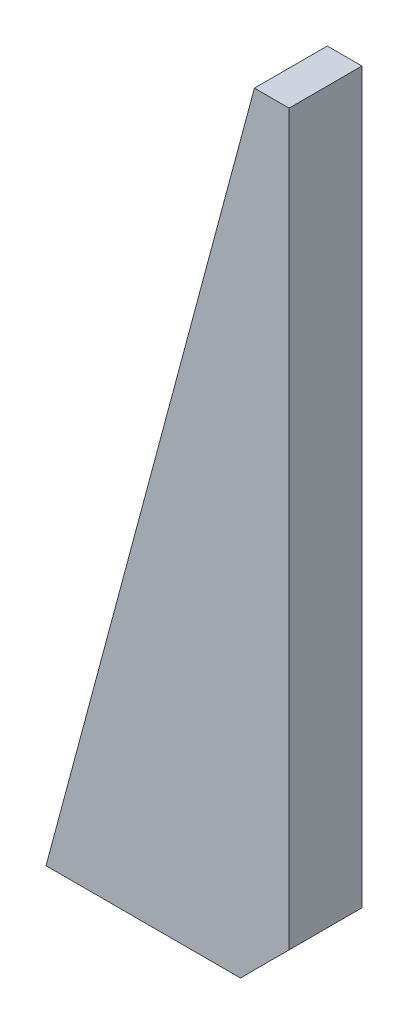
from build123d import *

# Parameters (mm, degrees)
BOSS_EXTRUDE1_DEPTH = 15
CHAMFER1_SIZE       = 10


with BuildPart() as part:
    # Sketch1 → Boss-Extrude1 (new body)
    with BuildSketch(Plane.XY):
        Polygon((0, 0), (0, 160), (-7.128129211, 160), (-16.425322587, 125.302401954), (-50, 0), align=None)
    extrude(amount=BOSS_EXTRUDE1_DEPTH)

    # Chamfer1
    chamfer1_edges = [part.edges().sort_by_distance(p)[0] for p in [
        (0, 0, 7.5),
    ]]
    chamfer(chamfer1_edges, length=CHAMFER1_SIZE)


solid = part.part
